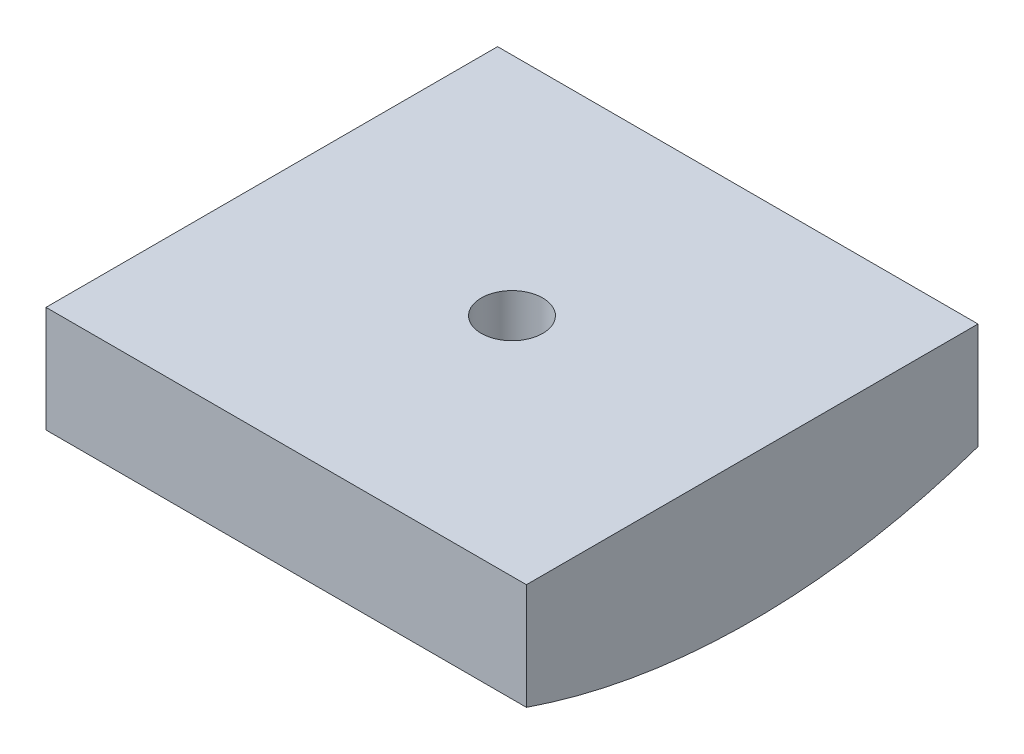
from build123d import *

# Parameters (mm, degrees)
BOSS_EXTRUDE1_DEPTH = 50
SKETCH2_R           = 3.2
CUT_EXTRUDE1_DEPTH  = 58.247270677


with BuildPart() as part:
    # Sketch1 → Boss-Extrude1 (new body)
    with BuildSketch(Plane(origin=(0, 0, 0), x_dir=(0, 0, -1), z_dir=(1, 0, 0))):
        with BuildLine():
            Line((-23.5, -57), (23.5, -57))
            Line((23.5, -57), (23.5, -68.056961437))
            ThreePointArc((23.5, -68.056961437), (0, -72), (-23.5, -68.056961437))
            Line((-23.5, -68.056961437), (-23.5, -57))
        make_face()
    extrude(amount=BOSS_EXTRUDE1_DEPTH)

    # Sketch2 → Cut-Extrude1 (cut, through all)
    with BuildSketch(Plane(origin=(0, -57, 0), x_dir=(1, 0, 0), z_dir=(0, 1, 0))):
        with Locations(Location((25, 0, 0), (0, 0, 270))):
            Circle(SKETCH2_R)
    extrude(amount=-CUT_EXTRUDE1_DEPTH, mode=Mode.SUBTRACT)


solid = part.part
